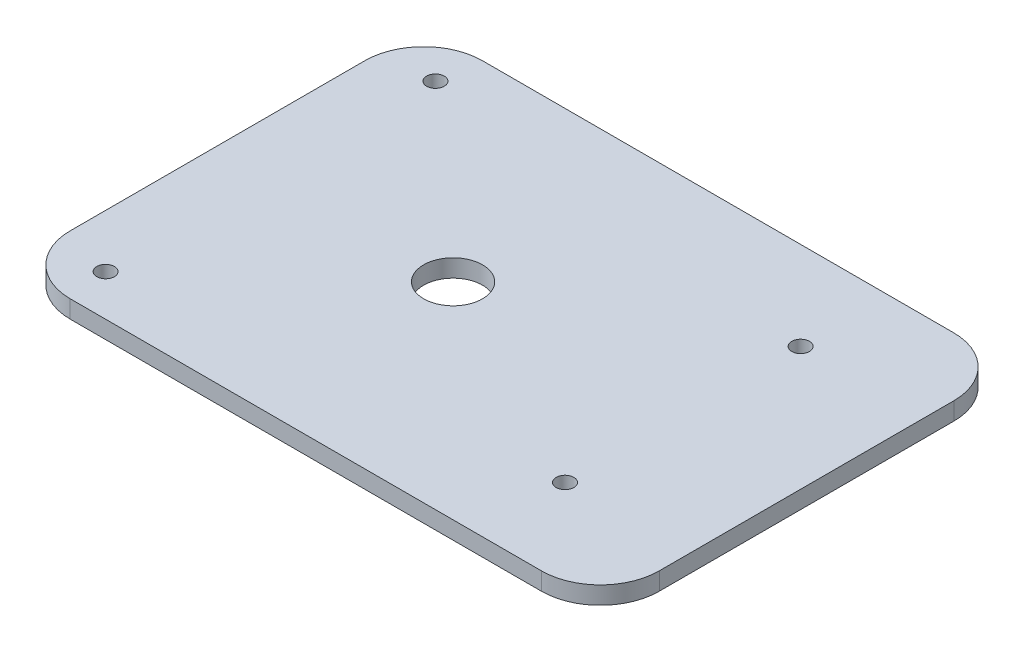
from build123d import *

# Parameters (mm, degrees)
SKETCH_1_W          = 100
SKETCH_1_H          = 70
EXTRUDE_1_DEPTH     = 3
FILLET_1_R          = 10
SKETCH_2_R          = 5
CUT_EXTRUDE_1_DEPTH = 70.526973183
SKETCH_3_R          = 1.5
CUT_EXTRUDE_2_DEPTH = 70.526973183


with BuildPart() as part:
    # 草图1 → 凸台-拉伸1 (new body)
    with BuildSketch(Plane(origin=(0, 0, 0), x_dir=(1, 0, 0), z_dir=(0, 1, 0))):
        with Locations((10, 0)):
            Rectangle(SKETCH_1_W, SKETCH_1_H)
    extrude(amount=EXTRUDE_1_DEPTH)

    # 圆角1
    fillet_1_edges = [part.edges().sort_by_distance(p)[0] for p in [
        (-40, 1.5, -35),
        (60, 1.5, -35),
        (60, 1.5, 35),
        (-40, 1.5, 35),
    ]]
    fillet(fillet_1_edges, radius=FILLET_1_R)

    # 草图2 → 切除-拉伸1 (cut, through all)
    with BuildSketch(Plane(origin=(0, 3, 0), x_dir=(1, 0, 0), z_dir=(0, 1, 0))):
        with Locations(Location((0, 0, 0), (0, 0, 270))):
            Circle(SKETCH_2_R)
    extrude(amount=-CUT_EXTRUDE_1_DEPTH, mode=Mode.SUBTRACT)

    # 草图3 → 切除-拉伸2 (cut, through all)
    with BuildSketch(Plane(origin=(0, 3, 0), x_dir=(1, 0, 0), z_dir=(0, 1, 0))):
        with Locations(Location((-31, 28, 0), (0, 0, 270))):
            Circle(SKETCH_3_R)
        with Locations(Location((39, 20, 0), (0, 0, 270))):
            Circle(SKETCH_3_R)
    cut_extrude_2 = extrude(amount=-CUT_EXTRUDE_2_DEPTH, mode=Mode.SUBTRACT)

    # 镜向1: 切除-拉伸2 across plane
    add(cut_extrude_2.mirror(Plane.XY), mode=Mode.SUBTRACT)


solid = part.part
